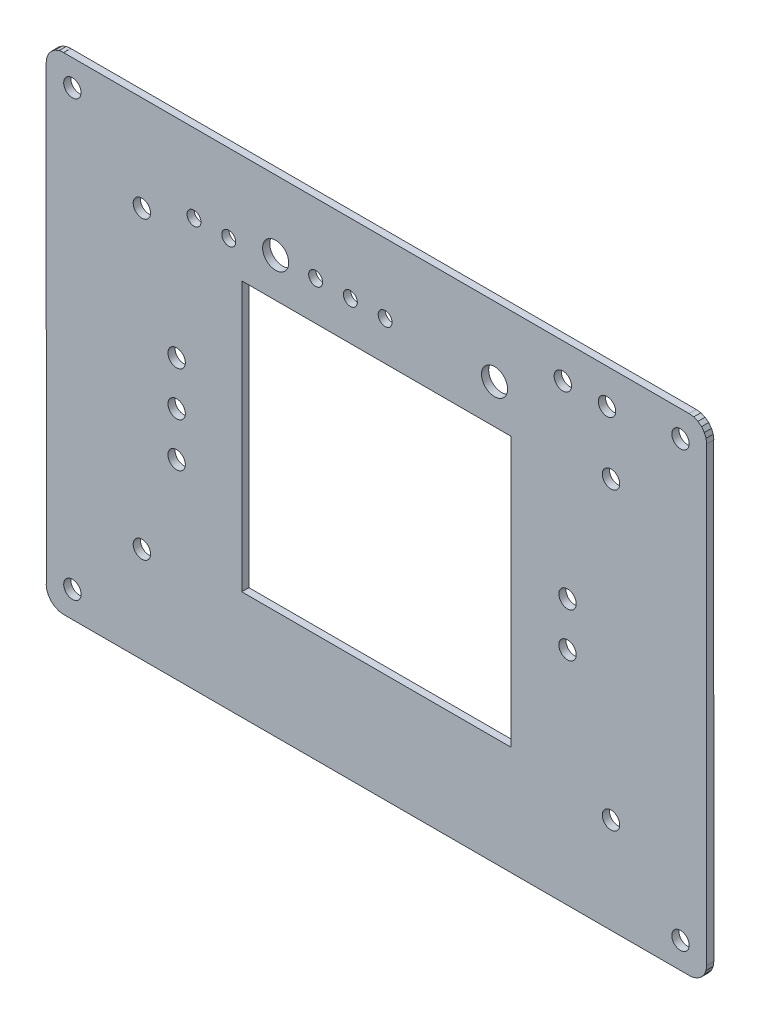
from build123d import *

# Parameters (mm, degrees)
SKETCH_1_R      = 0.499999
SKETCH_1_R_2    = 0.3999992
SKETCH_1_R_3    = 0.7499985
SKETCH_1_W      = 15.49999948
SKETCH_1_H      = 15.49999948
EXTRUDE_1_DEPTH = 0.41148


with BuildPart() as part:
    # 草图1 → 凸台-拉伸1 (new body)
    with BuildSketch(Plane.XY):
        Polygon((1.5257399, 2.2389465), (1.6265017, 1.99568562), (1.78679094, 1.78679094), (1.99568562, 1.6265017), (2.2389465, 1.5257399), (2.50000008, 1.49137116), (38.4999992, 1.49999954), (38.4999992, 1.49137116), (38.76105278, 1.5257399), (39.00431366, 1.6265017), (39.21320834, 1.78679094), (39.37349758, 1.99568562), (39.47425938, 2.2389465), (39.50862812, 2.50000008), (39.49999974, 28.49999888), (39.50862812, 28.49999888), (39.47425938, 28.76105246), (39.37349758, 29.00431334), (39.21320834, 29.21320802), (39.00431366, 29.37349726), (38.76105278, 29.47425906), (38.4999992, 29.5086278), (2.50000008, 29.49999942), (2.50000008, 29.5086278), (2.2389465, 29.47425906), (1.99568562, 29.37349726), (1.78679094, 29.21320802), (1.6265017, 29.00431334), (1.5257399, 28.76105246), (1.49137116, 28.49999888), (1.49999954, 2.50000008), (1.49137116, 2.50000008), align=None)
        with Locations(Location((38.0000002, 27.99999988, 0), (0, 0, 180))):
            Circle(SKETCH_1_R, mode=Mode.SUBTRACT)
        with Locations(Location((33.77000104, 27.50000088, 0), (0, 0, 180))):
            Circle(SKETCH_1_R, mode=Mode.SUBTRACT)
        with Locations(Location((31.23000104, 27.50000088, 0), (0, 0, 180))):
            Circle(SKETCH_1_R, mode=Mode.SUBTRACT)
        with Locations(Location((19.0000001, 25.4999998, 0), (0, 0, 180))):
            Circle(SKETCH_1_R_2, mode=Mode.SUBTRACT)
        with Locations(Location((16.99999902, 25.4999998, 0), (0, 0, 180))):
            Circle(SKETCH_1_R_2, mode=Mode.SUBTRACT)
        with Locations(Location((21.00000118, 25.4999998, 0), (0, 0, 180))):
            Circle(SKETCH_1_R_2, mode=Mode.SUBTRACT)
        with Locations(Location((34.00000058, 7.00000124, 0), (0, 0, 180))):
            Circle(SKETCH_1_R, mode=Mode.SUBTRACT)
        with Locations(Location((34.00000058, 24.00000026, 0), (0, 0, 180))):
            Circle(SKETCH_1_R, mode=Mode.SUBTRACT)
        with Locations(Location((38.0000002, 2.99999908, 0), (0, 0, 180))):
            Circle(SKETCH_1_R, mode=Mode.SUBTRACT)
        with Locations(Location((31.5000005, 16.76999948, 0), (0, 0, 180))):
            Circle(SKETCH_1_R, mode=Mode.SUBTRACT)
        with Locations(Location((27.29999874, 25.4999998, 0), (0, 0, 180))):
            Circle(SKETCH_1_R_3, mode=Mode.SUBTRACT)
        with Locations(Location((31.5000005, 14.22999948, 0), (0, 0, 180))):
            Circle(SKETCH_1_R, mode=Mode.SUBTRACT)
        with Locations(Location((14.70000108, 25.4999998, 0), (0, 0, 180))):
            Circle(SKETCH_1_R_3, mode=Mode.SUBTRACT)
        with Locations(Location((12.0000014, 25.0000008, 0), (0, 0, 180))):
            Circle(SKETCH_1_R_2, mode=Mode.SUBTRACT)
        with Locations(Location((10.00000032, 25.0000008, 0), (0, 0, 180))):
            Circle(SKETCH_1_R_2, mode=Mode.SUBTRACT)
        with Locations(Location((6.9999987, 24.00000026, 0), (0, 0, 180))):
            Circle(SKETCH_1_R, mode=Mode.SUBTRACT)
        with Locations(Location((2.99999908, 27.99999988, 0), (0, 0, 180))):
            Circle(SKETCH_1_R, mode=Mode.SUBTRACT)
        with Locations(Location((8.99999978, 17.54000048, 0), (0, 0, 180))):
            Circle(SKETCH_1_R, mode=Mode.SUBTRACT)
        with Locations(Location((8.99999978, 15.00000048, 0), (0, 0, 180))):
            Circle(SKETCH_1_R, mode=Mode.SUBTRACT)
        with Locations(Location((8.99999978, 12.46000048, 0), (0, 0, 180))):
            Circle(SKETCH_1_R, mode=Mode.SUBTRACT)
        with Locations(Location((6.9999987, 7.00000124, 0), (0, 0, 180))):
            Circle(SKETCH_1_R, mode=Mode.SUBTRACT)
        with Locations(Location((2.99999908, 2.99999908, 0), (0, 0, 180))):
            Circle(SKETCH_1_R, mode=Mode.SUBTRACT)
        with Locations((20.49999964, 15.49999948)):
            Rectangle(SKETCH_1_W, SKETCH_1_H, mode=Mode.SUBTRACT)
    extrude(amount=-EXTRUDE_1_DEPTH)


solid = part.part
